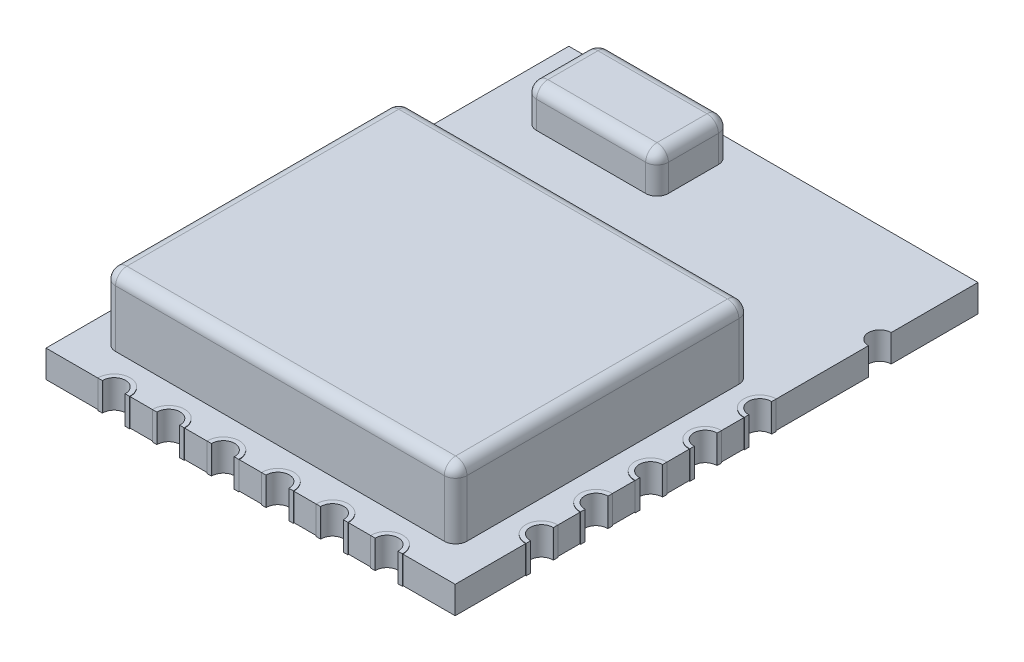
from build123d import *

# Parameters (mm, degrees)
BOSS_EXTRUDE1_DEPTH      = 0.6
SKETCH3_W                = 7.73
SKETCH3_H                = 6.48
BOSS_EXTRUDE2_DEPTH      = 1.5
FILLET1_R                = 0.25
SKETCH4_W                = 2.9
SKETCH4_H                = 1.6
BOSS_EXTRUDE3_DEPTH      = 0.84375
FILLET2_R                = 0.25
BOSS_EXTRUDE4_DEPTH      = 0.01
BOSS_EXTRUDE4_DEPTH_BACK = 0.61
BOSS_EXTRUDE5_START      = 0.01
BOSS_EXTRUDE5_DEPTH      = 0.01
SKETCH8_W                = 0.1
SKETCH8_H                = 0.62
BOSS_EXTRUDE6_DEPTH      = 0.01
SKETCH10_W               = 0.1
SKETCH10_H               = 0.62
BOSS_EXTRUDE7_DEPTH      = 0.01
SKETCH9_W                = 0.1
SKETCH9_H                = 0.62
BOSS_EXTRUDE8_DEPTH      = 0.01


with BuildPart() as part:
    # Sketch2 → Boss-Extrude1 (new body)
    with BuildSketch(Plane(origin=(0, 0, 0), x_dir=(1, 0, 0), z_dir=(0, 1, 0))):
        with BuildLine():
            Line((-4.5, -5.75), (-4.5, -4.1))
            ThreePointArc((-4.5, -4.1), (-4.25, -3.85), (-4.5, -3.6))
            Line((-4.5, -3.6), (-4.5, -2.9))
            ThreePointArc((-4.5, -2.9), (-4.25, -2.65), (-4.5, -2.4))
            Line((-4.5, -2.4), (-4.5, -1.7))
            ThreePointArc((-4.5, -1.7), (-4.25, -1.45), (-4.5, -1.2))
            Line((-4.5, -1.2), (-4.5, -0.5))
            ThreePointArc((-4.5, -0.5), (-4.25, -0.25), (-4.5, 0))
            Line((-4.5, 0), (-4.5, 0.7))
            ThreePointArc((-4.5, 0.7), (-4.25, 0.95), (-4.5, 1.2))
            Line((-4.5, 1.2), (-4.5, 5.75))
            Line((-4.5, 5.75), (4.5, 5.75))
            Line((4.5, 5.75), (4.5, 3.84))
            ThreePointArc((4.5, 3.84), (4.25, 3.59), (4.5, 3.34))
            Line((4.5, 3.34), (4.5, 1.2))
            ThreePointArc((4.5, 1.2), (4.25, 0.95), (4.5, 0.7))
            Line((4.5, 0.7), (4.5, 0))
            ThreePointArc((4.5, 0), (4.25, -0.25), (4.5, -0.5))
            Line((4.5, -0.5), (4.5, -1.2))
            ThreePointArc((4.5, -1.2), (4.25, -1.45), (4.5, -1.7))
            Line((4.5, -1.7), (4.5, -2.4))
            ThreePointArc((4.5, -2.4), (4.25, -2.65), (4.5, -2.9))
            Line((4.5, -2.9), (4.5, -3.6))
            ThreePointArc((4.5, -3.6), (4.25, -3.85), (4.5, -4.1))
            Line((4.5, -4.1), (4.5, -5.75))
            Line((4.5, -5.75), (3.25, -5.75))
            ThreePointArc((3.25, -5.75), (3, -5.5), (2.75, -5.75))
            Line((2.75, -5.75), (2.05, -5.75))
            ThreePointArc((2.05, -5.75), (1.8, -5.5), (1.55, -5.75))
            Line((1.55, -5.75), (0.85, -5.75))
            ThreePointArc((0.85, -5.75), (0.6, -5.5), (0.35, -5.75))
            Line((0.35, -5.75), (-0.35, -5.75))
            ThreePointArc((-0.35, -5.75), (-0.6, -5.5), (-0.85, -5.75))
            Line((-0.85, -5.75), (-1.55, -5.75))
            ThreePointArc((-1.55, -5.75), (-1.8, -5.5), (-2.05, -5.75))
            Line((-2.05, -5.75), (-2.75, -5.75))
            ThreePointArc((-2.75, -5.75), (-3, -5.5), (-3.25, -5.75))
            Line((-3.25, -5.75), (-4.5, -5.75))
        make_face()
    extrude(amount=BOSS_EXTRUDE1_DEPTH)

    # Sketch3 → Boss-Extrude2 (add)
    with BuildSketch(Plane(origin=(0, 0.6, 0), x_dir=(1, 0, 0), z_dir=(0, 1, 0))):
        with Locations((-0.055, -1.81)):
            Rectangle(SKETCH3_W, SKETCH3_H)
    extrude(amount=BOSS_EXTRUDE2_DEPTH)

    # Fillet1
    fillet1_edges = [part.edges().sort_by_distance(p)[0] for p in [
        (3.81, 2.1, 1.81),
        (3.81, 1.35, 5.05),
        (3.81, 1.35, -1.43),
        (-3.92, 1.35, -1.43),
        (-3.92, 1.35, 5.05),
        (-0.055, 2.1, -1.43),
        (-3.92, 2.1, 1.81),
        (-0.055, 2.1, 5.05),
    ]]
    fillet(fillet1_edges, radius=FILLET1_R)

    # Sketch4 → Boss-Extrude3 (add)
    with BuildSketch(Plane(origin=(0, 0.6, 0), x_dir=(1, 0, 0), z_dir=(0, 1, 0))):
        with Locations((-2.05, 4.59)):
            Rectangle(SKETCH4_W, SKETCH4_H)
    extrude(amount=BOSS_EXTRUDE3_DEPTH)

    # Fillet2
    fillet2_edges = [part.edges().sort_by_distance(p)[0] for p in [
        (-3.5, 1.021875, -5.39),
        (-3.5, 1.021875, -3.79),
        (-0.6, 1.44375, -4.59),
        (-0.6, 1.021875, -3.79),
        (-2.05, 1.44375, -5.39),
        (-0.6, 1.021875, -5.39),
        (-3.5, 1.44375, -4.59),
        (-2.05, 1.44375, -3.79),
    ]]
    fillet(fillet2_edges, radius=FILLET2_R)

    # Sketch6 → Boss-Extrude4 (add, two sides: drawn at the far end of the back side and taken through both)
    with BuildSketch(Plane.XZ.offset(-BOSS_EXTRUDE4_DEPTH_BACK)):
        with BuildLine():
            ThreePointArc((-4.5, -1.3), (-4.15, -0.95), (-4.5, -0.6))
            Line((-4.5, -0.6), (-4.5, -0.7))
            ThreePointArc((-4.5, -0.7), (-4.25, -0.95), (-4.5, -1.2))
            Line((-4.5, -1.2), (-4.5, -1.3))
        make_face()
        with BuildLine():
            Line((-3.25, 5.75), (-3.35, 5.75))
            ThreePointArc((-3.35, 5.75), (-3, 5.4), (-2.65, 5.75))
            Line((-2.65, 5.75), (-2.75, 5.75))
            ThreePointArc((-2.75, 5.75), (-3, 5.5), (-3.25, 5.75))
        make_face()
        with BuildLine():
            Line((-2.05, 5.75), (-2.15, 5.75))
            ThreePointArc((-2.15, 5.75), (-1.8, 5.4), (-1.45, 5.75))
            Line((-1.45, 5.75), (-1.55, 5.75))
            ThreePointArc((-1.55, 5.75), (-1.8, 5.5), (-2.05, 5.75))
        make_face()
        with BuildLine():
            Line((-0.85, 5.75), (-0.95, 5.75))
            ThreePointArc((-0.95, 5.75), (-0.6, 5.4), (-0.25, 5.75))
            Line((-0.25, 5.75), (-0.35, 5.75))
            ThreePointArc((-0.35, 5.75), (-0.6, 5.5), (-0.85, 5.75))
        make_face()
        with BuildLine():
            Line((0.35, 5.75), (0.25, 5.75))
            ThreePointArc((0.25, 5.75), (0.6, 5.4), (0.95, 5.75))
            Line((0.95, 5.75), (0.85, 5.75))
            ThreePointArc((0.85, 5.75), (0.6, 5.5), (0.35, 5.75))
        make_face()
        with BuildLine():
            Line((1.55, 5.75), (1.45, 5.75))
            ThreePointArc((1.45, 5.75), (1.8, 5.4), (2.15, 5.75))
            Line((2.15, 5.75), (2.05, 5.75))
            ThreePointArc((2.05, 5.75), (1.8, 5.5), (1.55, 5.75))
        make_face()
        with BuildLine():
            Line((2.75, 5.75), (2.65, 5.75))
            ThreePointArc((2.65, 5.75), (3, 5.4), (3.35, 5.75))
            Line((3.35, 5.75), (3.25, 5.75))
            ThreePointArc((3.25, 5.75), (3, 5.5), (2.75, 5.75))
        make_face()
        with BuildLine():
            Line((4.5, 4.1), (4.5, 4.2))
            ThreePointArc((4.5, 4.2), (4.15, 3.85), (4.5, 3.5))
            Line((4.5, 3.5), (4.5, 3.6))
            ThreePointArc((4.5, 3.6), (4.25, 3.85), (4.5, 4.1))
        make_face()
        with BuildLine():
            Line((4.5, 2.9), (4.5, 3))
            ThreePointArc((4.5, 3), (4.15, 2.65), (4.5, 2.3))
            Line((4.5, 2.3), (4.5, 2.4))
            ThreePointArc((4.5, 2.4), (4.25, 2.65), (4.5, 2.9))
        make_face()
        with BuildLine():
            Line((4.5, 1.7), (4.5, 1.8))
            ThreePointArc((4.5, 1.8), (4.15, 1.45), (4.5, 1.1))
            Line((4.5, 1.1), (4.5, 1.2))
            ThreePointArc((4.5, 1.2), (4.25, 1.45), (4.5, 1.7))
        make_face()
        with BuildLine():
            Line((4.5, 0.5), (4.5, 0.6))
            ThreePointArc((4.5, 0.6), (4.15, 0.25), (4.5, -0.1))
            Line((4.5, -0.1), (4.5, 0))
            ThreePointArc((4.5, 0), (4.25, 0.25), (4.5, 0.5))
        make_face()
        with BuildLine():
            Line((4.5, -0.7), (4.5, -0.6))
            ThreePointArc((4.5, -0.6), (4.15, -0.95), (4.5, -1.3))
            Line((4.5, -1.3), (4.5, -1.2))
            ThreePointArc((4.5, -1.2), (4.25, -0.95), (4.5, -0.7))
        make_face()
        with BuildLine():
            ThreePointArc((-4.5, 3.6), (-4.25, 3.85), (-4.5, 4.1))
            Line((-4.5, 4.1), (-4.5, 4.2))
            ThreePointArc((-4.5, 4.2), (-4.15, 3.85), (-4.5, 3.5))
            Line((-4.5, 3.5), (-4.5, 3.6))
        make_face()
        with BuildLine():
            ThreePointArc((-4.5, 2.4), (-4.25, 2.65), (-4.5, 2.9))
            Line((-4.5, 2.9), (-4.5, 3))
            ThreePointArc((-4.5, 3), (-4.15, 2.65), (-4.5, 2.3))
            Line((-4.5, 2.3), (-4.5, 2.4))
        make_face()
        with BuildLine():
            ThreePointArc((-4.5, 1.1), (-4.15, 1.45), (-4.5, 1.8))
            Line((-4.5, 1.8), (-4.5, 1.7))
            ThreePointArc((-4.5, 1.7), (-4.25, 1.45), (-4.5, 1.2))
            Line((-4.5, 1.2), (-4.5, 1.1))
        make_face()
        with BuildLine():
            ThreePointArc((-4.5, 0), (-4.25, 0.25), (-4.5, 0.5))
            Line((-4.5, 0.5), (-4.5, 0.6))
            ThreePointArc((-4.5, 0.6), (-4.15, 0.25), (-4.5, -0.1))
            Line((-4.5, -0.1), (-4.5, 0))
        make_face()
    extrude(amount=BOSS_EXTRUDE4_DEPTH + BOSS_EXTRUDE4_DEPTH_BACK)

    # Sketch7 → Boss-Extrude5 (add)
    with BuildSketch(Plane.XZ.offset(BOSS_EXTRUDE5_START)):
        with BuildLine():
            Line((-4.5, 2.4), (-4.5, 2.3))
            Line((-4.5, 2.3), (-3.5, 2.3))
            Line((-3.5, 2.3), (-3.5, 3))
            Line((-3.5, 3), (-4.5, 3))
            Line((-4.5, 3), (-4.5, 2.9))
            ThreePointArc((-4.5, 2.9), (-4.25, 2.65), (-4.5, 2.4))
        make_face()
        with BuildLine():
            Line((-4.5, 3.6), (-4.5, 3.5))
            Line((-4.5, 3.5), (-3.5, 3.5))
            Line((-3.5, 3.5), (-3.5, 4.2))
            Line((-3.5, 4.2), (-4.5, 4.2))
            Line((-4.5, 4.2), (-4.5, 4.1))
            ThreePointArc((-4.5, 4.1), (-4.25, 3.85), (-4.5, 3.6))
        make_face()
        with BuildLine():
            Line((-4.5, 1.2), (-4.5, 1.1))
            Line((-4.5, 1.1), (-3.5, 1.1))
            Line((-3.5, 1.1), (-3.5, 1.8))
            Line((-3.5, 1.8), (-4.5, 1.8))
            Line((-4.5, 1.8), (-4.5, 1.7))
            ThreePointArc((-4.5, 1.7), (-4.25, 1.45), (-4.5, 1.2))
        make_face()
        with BuildLine():
            Line((-4.5, 0), (-4.5, -0.1))
            Line((-4.5, -0.1), (-3.5, -0.1))
            Line((-3.5, -0.1), (-3.5, 0.6))
            Line((-3.5, 0.6), (-4.5, 0.6))
            Line((-4.5, 0.6), (-4.5, 0.5))
            ThreePointArc((-4.5, 0.5), (-4.25, 0.25), (-4.5, 0))
        make_face()
        with BuildLine():
            Line((-4.5, -1.2), (-4.5, -1.3))
            Line((-4.5, -1.3), (-3.5, -1.3))
            Line((-3.5, -1.3), (-3.5, -0.6))
            Line((-3.5, -0.6), (-4.5, -0.6))
            Line((-4.5, -0.6), (-4.5, -0.7))
            ThreePointArc((-4.5, -0.7), (-4.25, -0.95), (-4.5, -1.2))
        make_face()
        with BuildLine():
            Line((3.5, -0.6), (3.5, -1.3))
            Line((3.5, -1.3), (4.5, -1.3))
            Line((4.5, -1.3), (4.5, -1.2))
            ThreePointArc((4.5, -1.2), (4.25, -0.95), (4.5, -0.7))
            Line((4.5, -0.7), (4.5, -0.6))
            Line((4.5, -0.6), (3.5, -0.6))
        make_face()
        with BuildLine():
            Line((3.5, 0.6), (3.5, -0.1))
            Line((3.5, -0.1), (4.5, -0.1))
            Line((4.5, -0.1), (4.5, 0))
            ThreePointArc((4.5, 0), (4.25, 0.25), (4.5, 0.5))
            Line((4.5, 0.5), (4.5, 0.6))
            Line((4.5, 0.6), (3.5, 0.6))
        make_face()
        with BuildLine():
            Line((3.5, 1.8), (3.5, 1.1))
            Line((3.5, 1.1), (4.5, 1.1))
            Line((4.5, 1.1), (4.5, 1.2))
            ThreePointArc((4.5, 1.2), (4.25, 1.45), (4.5, 1.7))
            Line((4.5, 1.7), (4.5, 1.8))
            Line((4.5, 1.8), (3.5, 1.8))
        make_face()
        with BuildLine():
            Line((3.5, 3), (3.5, 2.3))
            Line((3.5, 2.3), (4.5, 2.3))
            Line((4.5, 2.3), (4.5, 2.4))
            ThreePointArc((4.5, 2.4), (4.25, 2.65), (4.5, 2.9))
            Line((4.5, 2.9), (4.5, 3))
            Line((4.5, 3), (3.5, 3))
        make_face()
        with BuildLine():
            Line((3.5, 4.2), (3.5, 3.5))
            Line((3.5, 3.5), (4.5, 3.5))
            Line((4.5, 3.5), (4.5, 3.6))
            ThreePointArc((4.5, 3.6), (4.25, 3.85), (4.5, 4.1))
            Line((4.5, 4.1), (4.5, 4.2))
            Line((4.5, 4.2), (3.5, 4.2))
        make_face()
        with BuildLine():
            Line((-2.05, 5.75), (-2.15, 5.75))
            Line((-2.15, 5.75), (-2.15, 4.75))
            Line((-2.15, 4.75), (-1.45, 4.75))
            Line((-1.45, 4.75), (-1.45, 5.75))
            Line((-1.45, 5.75), (-1.55, 5.75))
            ThreePointArc((-1.55, 5.75), (-1.8, 5.5), (-2.05, 5.75))
        make_face()
        with BuildLine():
            Line((-3.25, 5.75), (-3.35, 5.75))
            Line((-3.35, 5.75), (-3.35, 4.75))
            Line((-3.35, 4.75), (-2.65, 4.75))
            Line((-2.65, 4.75), (-2.65, 5.75))
            Line((-2.65, 5.75), (-2.75, 5.75))
            ThreePointArc((-2.75, 5.75), (-3, 5.5), (-3.25, 5.75))
        make_face()
        with BuildLine():
            Line((-0.85, 5.75), (-0.95, 5.75))
            Line((-0.95, 5.75), (-0.95, 4.75))
            Line((-0.95, 4.75), (-0.25, 4.75))
            Line((-0.25, 4.75), (-0.25, 5.75))
            Line((-0.25, 5.75), (-0.35, 5.75))
            ThreePointArc((-0.35, 5.75), (-0.6, 5.5), (-0.85, 5.75))
        make_face()
        with BuildLine():
            Line((0.35, 5.75), (0.25, 5.75))
            Line((0.25, 5.75), (0.25, 4.75))
            Line((0.25, 4.75), (0.95, 4.75))
            Line((0.95, 4.75), (0.95, 5.75))
            Line((0.95, 5.75), (0.85, 5.75))
            ThreePointArc((0.85, 5.75), (0.6, 5.5), (0.35, 5.75))
        make_face()
        with BuildLine():
            Line((1.55, 5.75), (1.45, 5.75))
            Line((1.45, 5.75), (1.45, 4.75))
            Line((1.45, 4.75), (2.15, 4.75))
            Line((2.15, 4.75), (2.15, 5.75))
            Line((2.15, 5.75), (2.05, 5.75))
            ThreePointArc((2.05, 5.75), (1.8, 5.5), (1.55, 5.75))
        make_face()
        with BuildLine():
            Line((2.75, 5.75), (2.65, 5.75))
            Line((2.65, 5.75), (2.65, 4.75))
            Line((2.65, 4.75), (3.35, 4.75))
            Line((3.35, 4.75), (3.35, 5.75))
            Line((3.35, 5.75), (3.25, 5.75))
            ThreePointArc((3.25, 5.75), (3, 5.5), (2.75, 5.75))
        make_face()
    extrude(amount=-BOSS_EXTRUDE5_DEPTH)

    # Sketch8 → Boss-Extrude6 (add)
    with BuildSketch(Plane(origin=(4.5, 0, 0), x_dir=(0, 0, -1), z_dir=(1, 0, 0))):
        with Locations((-3.55, 0.3)):
            Rectangle(SKETCH8_W, SKETCH8_H)
        with Locations((-4.15, 0.3)):
            Rectangle(SKETCH8_W, SKETCH8_H)
        with Locations((-2.95, 0.3)):
            Rectangle(SKETCH8_W, SKETCH8_H)
        with Locations((-2.35, 0.3)):
            Rectangle(SKETCH8_W, SKETCH8_H)
        with Locations((-1.75, 0.3)):
            Rectangle(SKETCH8_W, SKETCH8_H)
        with Locations((-1.15, 0.3)):
            Rectangle(SKETCH8_W, SKETCH8_H)
        with Locations((-0.55, 0.3)):
            Rectangle(SKETCH8_W, SKETCH8_H)
        with Locations((0.05, 0.3)):
            Rectangle(SKETCH8_W, SKETCH8_H)
        with Locations((0.65, 0.3)):
            Rectangle(SKETCH8_W, SKETCH8_H)
        with Locations((1.25, 0.3)):
            Rectangle(SKETCH8_W, SKETCH8_H)
    extrude(amount=BOSS_EXTRUDE6_DEPTH)

    # Sketch10 → Boss-Extrude7 (add)
    with BuildSketch(Plane.ZY.offset(4.5)):
        with Locations((-0.65, 0.3)):
            Rectangle(SKETCH10_W, SKETCH10_H)
        with Locations((-1.25, 0.3)):
            Rectangle(SKETCH10_W, SKETCH10_H)
        with Locations((-0.05, 0.3)):
            Rectangle(SKETCH10_W, SKETCH10_H)
        with Locations((0.55, 0.3)):
            Rectangle(SKETCH10_W, SKETCH10_H)
        with Locations((1.15, 0.3)):
            Rectangle(SKETCH10_W, SKETCH10_H)
        with Locations((1.75, 0.3)):
            Rectangle(SKETCH10_W, SKETCH10_H)
        with Locations((2.35, 0.3)):
            Rectangle(SKETCH10_W, SKETCH10_H)
        with Locations((2.95, 0.3)):
            Rectangle(SKETCH10_W, SKETCH10_H)
        with Locations((3.55, 0.3)):
            Rectangle(SKETCH10_W, SKETCH10_H)
        with Locations((4.15, 0.3)):
            Rectangle(SKETCH10_W, SKETCH10_H)
    extrude(amount=BOSS_EXTRUDE7_DEPTH)

    # Sketch9 → Boss-Extrude8 (add)
    with BuildSketch(Plane.XY.offset(5.75)):
        with Locations((-2.7, 0.3)):
            Rectangle(SKETCH9_W, SKETCH9_H)
        with Locations((-3.3, 0.3)):
            Rectangle(SKETCH9_W, SKETCH9_H)
        with Locations((-2.1, 0.3)):
            Rectangle(SKETCH9_W, SKETCH9_H)
        with Locations((-1.5, 0.3)):
            Rectangle(SKETCH9_W, SKETCH9_H)
        with Locations((-0.9, 0.3)):
            Rectangle(SKETCH9_W, SKETCH9_H)
        with Locations((-0.3, 0.3)):
            Rectangle(SKETCH9_W, SKETCH9_H)
        with Locations((0.3, 0.3)):
            Rectangle(SKETCH9_W, SKETCH9_H)
        with Locations((0.9, 0.3)):
            Rectangle(SKETCH9_W, SKETCH9_H)
        with Locations((1.5, 0.3)):
            Rectangle(SKETCH9_W, SKETCH9_H)
        with Locations((2.1, 0.3)):
            Rectangle(SKETCH9_W, SKETCH9_H)
        with Locations((2.7, 0.3)):
            Rectangle(SKETCH9_W, SKETCH9_H)
        with Locations((3.3, 0.3)):
            Rectangle(SKETCH9_W, SKETCH9_H)
    extrude(amount=BOSS_EXTRUDE8_DEPTH)


solid = part.part
